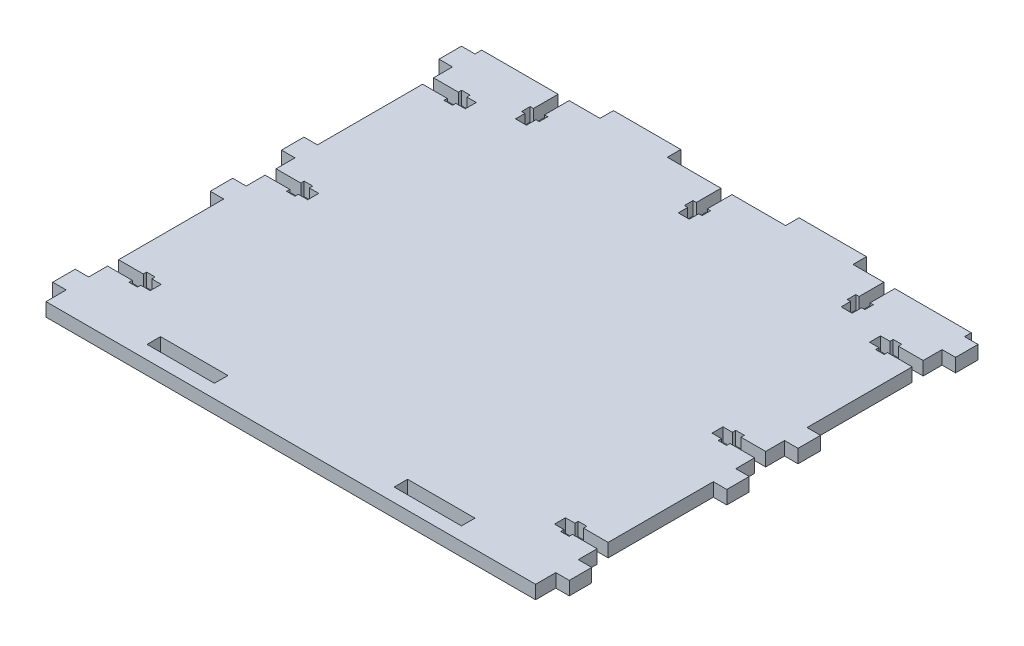
from build123d import *

# Parameters (mm, degrees)
EXTRUDE_1_DEPTH          = 6
SKETCH_2_W               = 218
SKETCH_2_H               = 6
EXTRUDE_2_DEPTH          = 6
CUT_EXTRUDE_5_DEPTH      = 153.515572975
CUT_EXTRUDE_5_DEPTH_BACK = 153.515572975
SKETCH_9_W               = 30
SKETCH_9_H               = 6


with BuildPart() as part:
    # Эскиз1 → Бобышка-Вытянуть1 (new body)
    with BuildSketch(Plane(origin=(0, 0, 0), x_dir=(1, 0, 0), z_dir=(0, 1, 0))):
        Polygon((26.333333333, 100), (26.333333333, 94), (2.45, 94), (2.45, 83), (3.925, 83), (3.925, 79.2), (2.45, 79.2), (2.45, 75), (-2.45, 75), (-2.45, 79.2), (-3.925, 79.2), (-3.925, 83), (-2.45, 83), (-2.45, 94), (-26.333333333, 94), (-26.333333333, 100), (-56.333333333, 100), (-56.333333333, 94), (-70.05, 94), (-70.05, 83), (-68.575, 83), (-68.575, 79.2), (-70.05, 79.2), (-70.05, 75), (-74.95, 75), (-74.95, 79.2), (-76.425, 79.2), (-76.425, 83), (-74.95, 83), (-74.95, 94), (-109, 94), (-109, 91), (-115, 91), (-115, 81), (-109, 81), (-109, 72.5875), (-98, 72.5875), (-98, 74.0625), (-94.2, 74.0625), (-94.2, 72.5875), (-90, 72.5875), (-90, 67.6875), (-94.2, 67.6875), (-94.2, 66.2125), (-98, 66.2125), (-98, 67.6875), (-109, 67.6875), (-109, 20.8625), (-115, 20.8625), (-115, 10.8625), (-109, 10.8625), (-109, 2.45), (-98, 2.45), (-98, 3.925), (-94.2, 3.925), (-94.2, 2.45), (-90, 2.45), (-90, -2.45), (-94.2, -2.45), (-94.2, -3.925), (-98, -3.925), (-98, -2.45), (-109, -2.45), (-109, -10.8625), (-115, -10.8625), (-115, -20.8625), (-109, -20.8625), (-109, -67.6875), (-98, -67.6875), (-98, -66.2125), (-94.2, -66.2125), (-94.2, -67.6875), (-90, -67.6875), (-90, -72.5875), (-94.2, -72.5875), (-94.2, -74.0625), (-98, -74.0625), (-98, -72.5875), (-109, -72.5875), (-109, -81), (-115, -81), (-115, -91), (-109, -91), (-109, -94), (109, -94), (109, -91), (115, -91), (115, -81), (109, -81), (109, -72.5875), (98, -72.5875), (98, -74.0625), (94.2, -74.0625), (94.2, -72.5875), (90, -72.5875), (90, -67.6875), (94.2, -67.6875), (94.2, -66.2125), (98, -66.2125), (98, -67.6875), (109, -67.6875), (109, -20.8625), (115, -20.8625), (115, -10.8625), (109, -10.8625), (109, -2.45), (98, -2.45), (98, -3.925), (94.2, -3.925), (94.2, -2.45), (90, -2.45), (90, 2.45), (94.2, 2.45), (94.2, 3.925), (98, 3.925), (98, 2.45), (109, 2.45), (109, 10.8625), (115, 10.8625), (115, 20.8625), (109, 20.8625), (109, 67.6875), (98, 67.6875), (98, 66.2125), (94.2, 66.2125), (94.2, 67.6875), (90, 67.6875), (90, 72.5875), (94.2, 72.5875), (94.2, 74.0625), (98, 74.0625), (98, 72.5875), (109, 72.5875), (109, 81), (115, 81), (115, 91), (109, 91), (109, 94), (74.95, 94), (74.95, 83), (76.425, 83), (76.425, 79.2), (74.95, 79.2), (74.95, 75), (70.05, 75), (70.05, 79.2), (68.575, 79.2), (68.575, 83), (70.05, 83), (70.05, 94), (56.333333333, 94), (56.333333333, 100), align=None)
    extrude(amount=EXTRUDE_1_DEPTH)

    # Эскиз2 → Бобышка-Вытянуть2 (add)
    with BuildSketch(Plane(origin=(0, 6, 0), x_dir=(1, 0, 0), z_dir=(0, 1, 0))):
        with Locations((0, -97)):
            Rectangle(SKETCH_2_W, SKETCH_2_H)
    extrude(amount=-EXTRUDE_2_DEPTH)

    # Эскиз9 → Вырез-Вытянуть5 (cut, two sides: drawn at the far end of the back side and taken through both)
    with BuildSketch(Plane(origin=(0, 6, 0), x_dir=(1, 0, 0), z_dir=(0, 1, 0)).offset(-CUT_EXTRUDE_5_DEPTH_BACK)):
        with Locations((-55, -91)):
            Rectangle(SKETCH_9_W, SKETCH_9_H)
        with Locations((55, -91)):
            Rectangle(SKETCH_9_W, SKETCH_9_H)
    extrude(amount=CUT_EXTRUDE_5_DEPTH + CUT_EXTRUDE_5_DEPTH_BACK, mode=Mode.SUBTRACT)


solid = part.part
